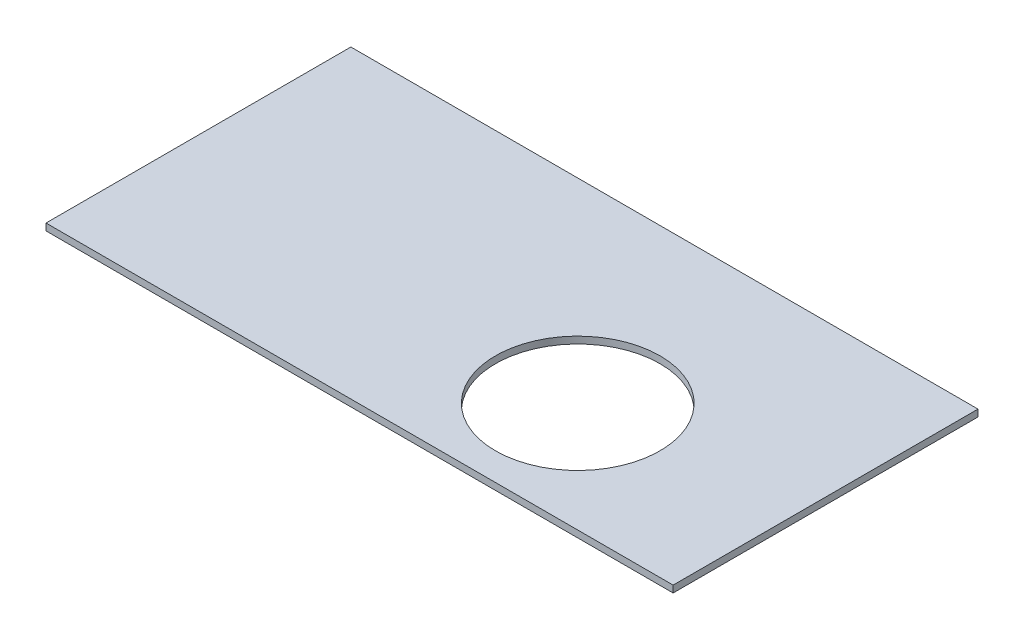
from build123d import *

# Parameters (mm, degrees)
SKETCH1_W           = 457.2
SKETCH1_H           = 222.25
BOSS_EXTRUDE1_DEPTH = 5
SKETCH2_R           = 60
CUT_EXTRUDE1_DEPTH  = 255.227704283


with BuildPart() as part:
    # Sketch1 → Boss-Extrude1 (new body)
    with BuildSketch(Plane(origin=(0, 0, 0), x_dir=(1, 0, 0), z_dir=(0, 1, 0))):
        Rectangle(SKETCH1_W, SKETCH1_H)
    extrude(amount=BOSS_EXTRUDE1_DEPTH)

    # Sketch2 → Cut-Extrude1 (cut, through all)
    with BuildSketch(Plane(origin=(0, 5, 0), x_dir=(1, 0, 0), z_dir=(0, 1, 0))):
        with Locations(Location((79.05, -31.125, 0), (0, 0, 270))):
            Circle(SKETCH2_R)
    extrude(amount=-CUT_EXTRUDE1_DEPTH, mode=Mode.SUBTRACT)


solid = part.part
